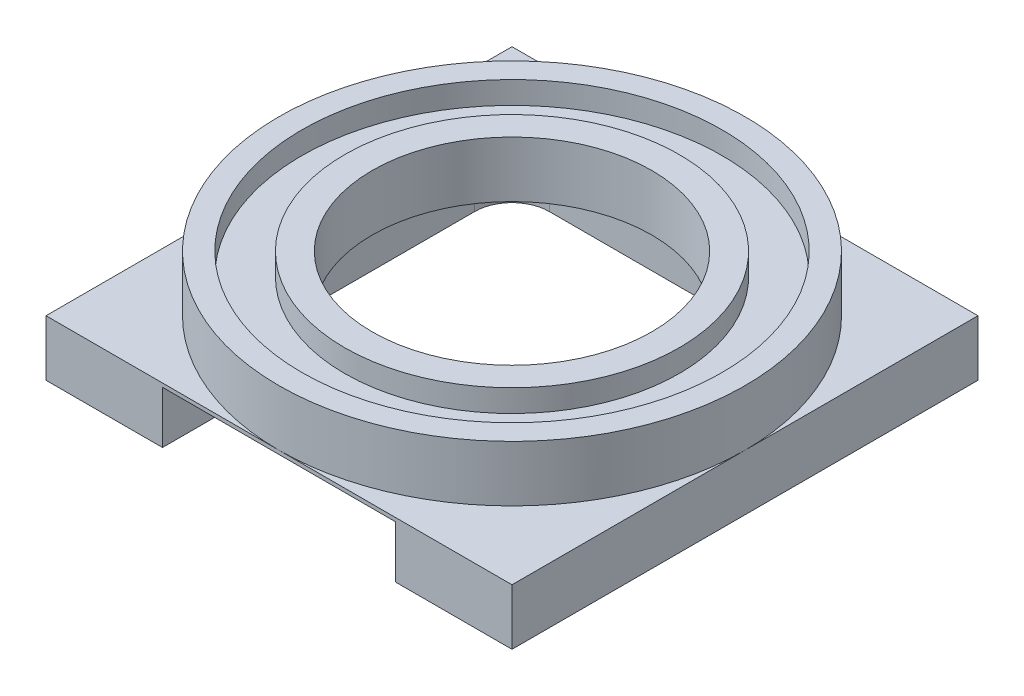
from build123d import *

# Parameters (mm, degrees)
AUFSATZ_LINEAR_AUSTRAGEN1_DEPTH = 30
SKIZZE2_R                       = 112.75
SKIZZE2_R_2                     = 89.75
SCHNITT_LINEAR_AUSTRAGEN1_DEPTH = 12
AUFSATZ_LINEAR_START            = 30
SKIZZE3_R                       = 125
AUFSATZ_LINEAR_AUSTRAGEN2_DEPTH = 30
SKIZZE4_W                       = 125
SKIZZE4_H                       = 28
SCHNITT_LINEAR_AUSTRAGEN2_DEPTH = 37


with BuildPart() as part:
    # Skizze1 → Aufsatz-Linear austragen1 (new body)
    with BuildSketch(Plane(origin=(0, 0, 0), x_dir=(1, 0, 0), z_dir=(0, 1, 0))):
        with BuildLine():
            ThreePointArc((0, 125), (-125, 0), (0, -125))
            Line((0, -125), (0, -112.75))
            ThreePointArc((0, -112.75), (-112.75, 0), (0, 112.75))
            Line((0, 112.75), (0, 125))
        make_face()
        with BuildLine():
            Line((0, -112.75), (0, -125))
            ThreePointArc((0, -125), (88.388347648, -88.388347648), (125, 0))
            ThreePointArc((125, 0), (88.388347648, 88.388347648), (0, 125))
            Line((0, 125), (0, 112.75))
            ThreePointArc((0, 112.75), (79.726289579, 79.726289579), (112.75, 0))
            ThreePointArc((112.75, 0), (79.726289579, -79.726289579), (0, -112.75))
        make_face()
        with BuildLine():
            ThreePointArc((0, 112.75), (-112.75, 0), (0, -112.75))
            Line((0, -112.75), (0, -89.75))
            ThreePointArc((0, -89.75), (-89.75, 0), (0, 89.75))
            Line((0, 89.75), (0, 112.75))
        make_face()
        with BuildLine():
            Line((0, -89.75), (0, -112.75))
            ThreePointArc((0, -112.75), (79.726289579, -79.726289579), (112.75, 0))
            ThreePointArc((112.75, 0), (79.726289579, 79.726289579), (0, 112.75))
            Line((0, 112.75), (0, 89.75))
            ThreePointArc((0, 89.75), (63.462833611, 63.462833611), (89.75, 0))
            ThreePointArc((89.75, 0), (63.462833611, -63.462833611), (0, -89.75))
        make_face()
        with BuildLine():
            ThreePointArc((0, 89.75), (-89.75, 0), (0, -89.75))
            Line((0, -89.75), (0, -75))
            ThreePointArc((0, -75), (-75, 0), (0, 75))
            Line((0, 75), (0, 89.75))
        make_face()
        with BuildLine():
            Line((0, -75), (0, -89.75))
            ThreePointArc((0, -89.75), (63.462833611, -63.462833611), (89.75, 0))
            ThreePointArc((89.75, 0), (63.462833611, 63.462833611), (0, 89.75))
            Line((0, 89.75), (0, 75))
            ThreePointArc((0, 75), (53.033008589, 53.033008589), (75, 0))
            ThreePointArc((75, 0), (53.033008589, -53.033008589), (0, -75))
        make_face()
    extrude(amount=AUFSATZ_LINEAR_AUSTRAGEN1_DEPTH)

    # Skizze2 → Schnitt-Linear austragen1 (cut)
    with BuildSketch(Plane(origin=(0, 30, 0), x_dir=(1, 0, 0), z_dir=(0, 1, 0))):
        with Locations(Location((0, 0, 0), (0, 0, 270))):
            Circle(SKIZZE2_R)
        with Locations(Location((0, 0, 0), (0, 0, 270))):
            Circle(SKIZZE2_R_2, mode=Mode.SUBTRACT)
    extrude(amount=-SCHNITT_LINEAR_AUSTRAGEN1_DEPTH, mode=Mode.SUBTRACT)

    # Skizze3 → Aufsatz-Linear austragen2 (add)
    # profile 1 of 5: a face of its own
    with BuildSketch(Plane.XZ.offset(AUFSATZ_LINEAR_START)):
        with Locations(Location((0, 0, 0), (0, 0, 90))):
            Circle(SKIZZE3_R)
        with BuildLine():
            Line((-88.388347648, -68.388347648), (-88.388347648, 68.388347648))
            ThreePointArc((-88.388347648, 68.388347648), (-82.530483272, 82.530483272), (-68.388347648, 88.388347648))
            Line((-68.388347648, 88.388347648), (68.388347648, 88.388347648))
            ThreePointArc((68.388347648, 88.388347648), (82.530483272, 82.530483272), (88.388347648, 68.388347648))
            Line((88.388347648, 68.388347648), (88.388347648, -68.388347648))
            ThreePointArc((88.388347648, -68.388347648), (82.530483272, -82.530483272), (68.388347648, -88.388347648))
            Line((68.388347648, -88.388347648), (-68.388347648, -88.388347648))
            ThreePointArc((-68.388347648, -88.388347648), (-82.530483272, -82.530483272), (-88.388347648, -68.388347648))
        make_face(mode=Mode.SUBTRACT)
    # profile 2 of 5: a face of its own
    with BuildSketch(Plane.XZ.offset(AUFSATZ_LINEAR_START)):
        with BuildLine():
            Line((-125, 125), (-125, 1.53e-07))
            ThreePointArc((-125, 1.53e-07), (-88.388347573, 88.388347723), (5.9e-08, 125))
            Line((5.9e-08, 125), (-125, 125))
        make_face()
    # profile 3 of 5: a face of its own
    with BuildSketch(Plane.XZ.offset(AUFSATZ_LINEAR_START)):
        with BuildLine():
            ThreePointArc((5.9e-08, 125), (88.388347669, 88.388347627), (125, 0))
            Line((125, 0), (125, 125))
            Line((125, 125), (5.9e-08, 125))
        make_face()
    # profile 4 of 5: a face of its own
    with BuildSketch(Plane.XZ.offset(AUFSATZ_LINEAR_START)):
        with BuildLine():
            ThreePointArc((125, 0), (88.388347702, -88.388347594), (1.52e-07, -125))
            Line((1.52e-07, -125), (125, -125))
            Line((125, -125), (125, 0))
        make_face()
    # profile 5 of 5: a face of its own
    with BuildSketch(Plane.XZ.offset(AUFSATZ_LINEAR_START)):
        with BuildLine():
            Line((-125, 1.53e-07), (-125, -125))
            Line((-125, -125), (1.52e-07, -125))
            ThreePointArc((1.52e-07, -125), (-88.388347648, -88.388347648), (-125, 1.53e-07))
        make_face()
    extrude(amount=-AUFSATZ_LINEAR_AUSTRAGEN2_DEPTH)

    # Skizze4 → Schnitt-Linear austragen2 (cut)
    with BuildSketch(Plane.XY.offset(125)):
        with Locations((0, -16)):
            Rectangle(SKIZZE4_W, SKIZZE4_H)
    extrude(amount=-SCHNITT_LINEAR_AUSTRAGEN2_DEPTH, mode=Mode.SUBTRACT)


solid = part.part
